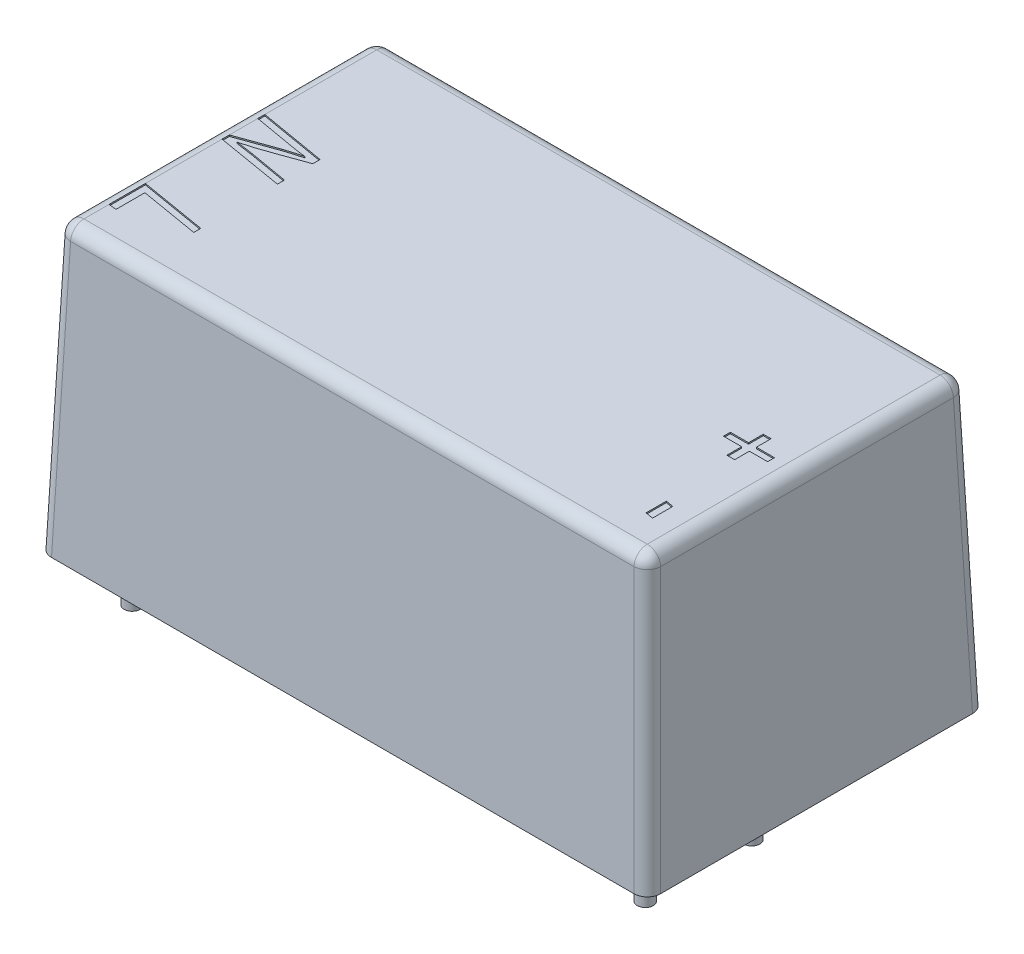
from build123d import *

# Parameters (mm, degrees)
SKETCH_1_W          = 45.7
SKETCH_1_H          = 25.4
EXTRUDE_1_DEPTH     = 21.5
EXTRUDE_1_TAPER     = 2
FILLET_1_R          = 1
SKETCH_2_R          = 0.6
EXTRUDE_2_DEPTH     = 3.5
CUT_EXTRUDE_1_DEPTH = 0.1


with BuildPart() as part:
    # Эскиз1 → Бобышка-Вытянуть1 (new body)
    with BuildSketch(Plane(origin=(0, 0, 0), x_dir=(1, 0, 0), z_dir=(0, 1, 0))):
        Rectangle(SKETCH_1_W, SKETCH_1_H)
    extrude(amount=EXTRUDE_1_DEPTH, taper=EXTRUDE_1_TAPER)

    # Скругление1
    fillet_1_edges = [part.edges().sort_by_distance(p)[0] for p in [
        (-22.099203456, 21.5, 0),
        (0, 21.5, 11.949203456),
        (22.099203456, 21.5, 0),
        (22.474601728, 10.75, 12.324601728),
        (-22.474601728, 10.75, 12.324601728),
        (-22.474601728, 10.75, -12.324601728),
        (22.474601728, 10.75, -12.324601728),
        (0, 21.5, -11.949203456),
    ]]
    fillet(fillet_1_edges, radius=FILLET_1_R)

    # Эскиз2 → Бобышка-Вытянуть2 (add)
    with BuildSketch(Plane.XZ):
        with Locations(Location((-19.25, 9.25, 0), (0, 0, 90))):
            Circle(SKETCH_2_R)
        with Locations(Location((19.25, 9.25, 0), (0, 0, 90))):
            Circle(SKETCH_2_R)
        with Locations(Location((19.25, 1.25, 0), (0, 0, 90))):
            Circle(SKETCH_2_R)
        with Locations(Location((-19.25, -1.5, 0), (0, 0, 90))):
            Circle(SKETCH_2_R)
    extrude(amount=EXTRUDE_2_DEPTH)

    # Эскиз3 → Вырез-Вытянуть1 (cut)
    with BuildSketch(Plane(origin=(0, 21.5, 0), x_dir=(1, 0, 0), z_dir=(0, 1, 0))):
        Polygon((19.640008188, -9.100397798), (19.055592603, -8.995892928), (19.055592603, -7.470933512), (19.640008188, -7.575438382), align=None)
        Polygon((20.289358837, -1.113384811), (18.925722473, -1.113384811), (18.925722473, -2.217280915), (18.341306889, -2.217280915), (18.341306889, -1.113384811), (16.977670525, -1.113384811), (16.977670525, -0.593904292), (18.341306889, -0.593904292), (18.341306889, 0.509991812), (18.925722473, 0.509991812), (18.925722473, -0.593904292), (20.289358837, -0.593904292), align=None)
        Polygon((-21.133514681, -6.373125071), (-16.133514681, -7.217280915), (-16.133514681, -7.742849097), (-20.549099097, -6.99711046), (-20.549099097, -9.165332863), (-21.133514681, -9.100397798), align=None)
        with BuildLine():
            Line((-21.133514681, 2.58791389), (-16.133514681, 1.733611942))
            Line((-16.133514681, 1.733611942), (-16.133514681, 1.185722332))
            Line((-16.133514681, 1.185722332), (-18.017646175, 0.50491876))
            add(Edge.make_bspline(
                [(-18.017646175, 0.50491876), (-18.084951638, 0.479901412), (-18.216446711, 0.431024873), (-18.409455405, 0.359102014), (-18.595117789, 0.294326278), (-18.771368832, 0.230303102), (-18.94005961, 0.173527591), (-19.099405054, 0.11756543), (-19.251272194, 0.068533592), (-19.349820298, 0.037152336), (-19.397516304, 0.021964215)],
                knots=[0, 0, 0, 0, 1.17864921, 2.302733803, 3.380832114, 4.40627524, 5.380631262, 6.302323787, 7.178346691, 8, 8, 8, 8], degree=3))
            add(Edge.make_bspline(
                [(-19.397516304, 0.021964215), (-19.466070769, 0.000654731), (-19.611110517, -0.044429456), (-19.843139107, -0.108631255), (-20.100830498, -0.176769053), (-20.281849123, -0.221474359), (-20.37661533, -0.244878317)],
                knots=[0, 0, 0, 0, 0.848709835, 1.795603867, 2.845962616, 4, 4, 4, 4], degree=3))
            add(Edge.make_bspline(
                [(-20.37661533, -0.244878317), (-20.158646903, -0.272468182), (-19.72000482, -0.327990331), (-19.28337221, -0.397574555), (-19.063709486, -0.43258124)],
                knots=[0, 0, 0, 0, 0.99383272, 2, 2, 2, 2], degree=3))
            Line((-19.063709486, -0.43258124), (-16.133514681, -0.940901045))
            Line((-16.133514681, -0.940901045), (-16.133514681, -1.468498447))
            Line((-16.133514681, -1.468498447), (-21.133514681, -0.622313382))
            Line((-21.133514681, -0.622313382), (-21.133514681, -0.074423772))
            Line((-21.133514681, -0.074423772), (-18.259123447, 0.965551877))
            add(Edge.make_bspline(
                [(-18.259123447, 0.965551877), (-18.13342725, 1.006165207), (-17.890654825, 1.084606694), (-17.5379298, 1.192033494), (-17.210066563, 1.286371648), (-16.998768155, 1.340422442), (-16.897516304, 1.366322981)],
                knots=[0, 0, 0, 0, 1.11654548, 2.156520707, 3.116625202, 4, 4, 4, 4], degree=3))
            add(Edge.make_bspline(
                [(-16.897516304, 1.366322981), (-16.98313031, 1.373970961), (-17.163429992, 1.390077303), (-17.446573636, 1.425294437), (-17.75612092, 1.470909488), (-17.970717493, 1.508204888), (-18.08258124, 1.527646033)],
                knots=[0, 0, 0, 0, 0.862057772, 1.815459291, 2.861254385, 4, 4, 4, 4], degree=3))
            Line((-18.08258124, 1.527646033), (-21.133514681, 2.062345708))
            Line((-21.133514681, 2.062345708), (-21.133514681, 2.58791389))
        make_face()
    extrude(amount=-CUT_EXTRUDE_1_DEPTH, mode=Mode.SUBTRACT)


solid = part.part
